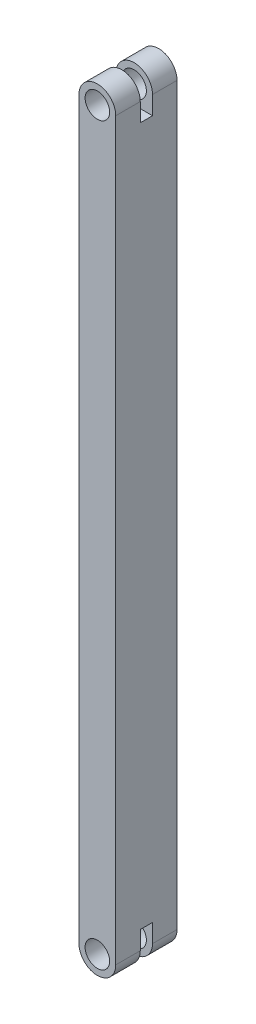
from build123d import *

# Parameters (mm, degrees)
EXTRUDE_1_DEPTH     = 25
SKETCH_2_W          = 5
SKETCH_2_H          = 15
CUT_EXTRUDE_1_DEPTH = 309.879021625
SKETCH_3_R          = 5
CUT_EXTRUDE_2_DEPTH = 309.605735527


with BuildPart() as part:
    # 草图1 → 凸台-拉伸1 (new body)
    with BuildSketch(Plane.XY):
        with BuildLine():
            Line((-7.5, 0), (-7.5, 300))
            ThreePointArc((-7.5, 300), (0, 307.5), (7.5, 300))
            Line((7.5, 300), (7.5, 0))
            ThreePointArc((7.5, 0), (0, -7.5), (-7.5, 0))
        make_face()
    extrude(amount=EXTRUDE_1_DEPTH)

    # 草图2 → 切除-拉伸1 (cut, through all)
    with BuildSketch(Plane(origin=(7.5, 0, 0), x_dir=(0, 0, -1), z_dir=(1, 0, 0))):
        with Locations((-12.5, 300)):
            Rectangle(SKETCH_2_W, SKETCH_2_H)
        with Locations((-12.5, 0)):
            Rectangle(SKETCH_2_W, SKETCH_2_H)
    extrude(amount=-CUT_EXTRUDE_1_DEPTH, mode=Mode.SUBTRACT)

    # 草图3 → 切除-拉伸2 (cut, through all)
    with BuildSketch(Plane.XY.offset(25)):
        with Locations((0, 300)):
            Circle(SKETCH_3_R)
        Circle(SKETCH_3_R)
    extrude(amount=-CUT_EXTRUDE_2_DEPTH, mode=Mode.SUBTRACT)


solid = part.part
